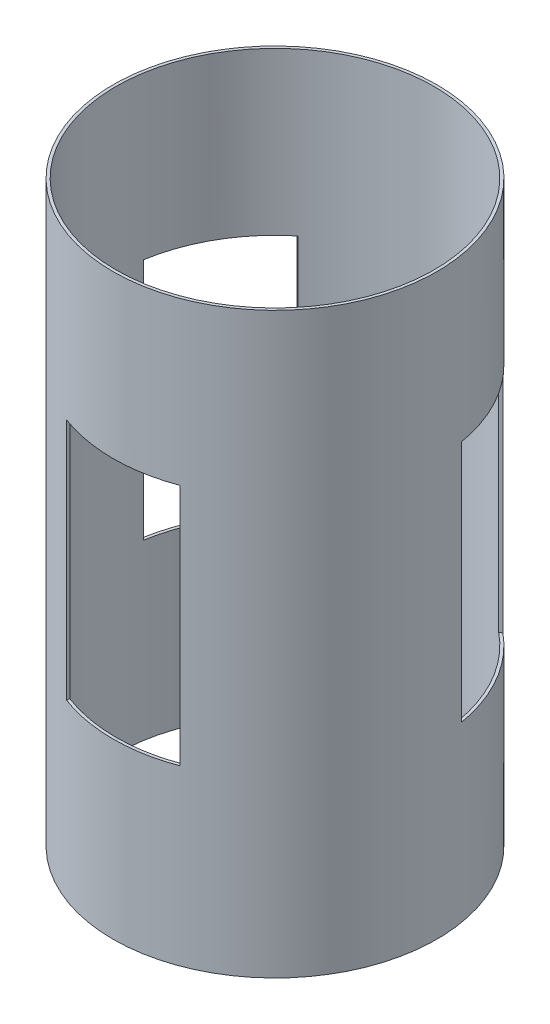
from build123d import *
from build123d.topology import SkipClean

# Parameters (mm, degrees)
BOSS_EXTRUDE7_DEPTH   = 105
BOSS_EXTRUDE7_2_DEPTH = 105
BOSS_EXTRUDE7_3_DEPTH = 105
BOSS_EXTRUDE8_START   = 105
BOSS_EXTRUDE8_DEPTH   = 70
BOSS_EXTRUDE9_START   = -75
BOSS_EXTRUDE9_DEPTH   = 75


with BuildPart() as part:
    # Sketch1 → Boss-Extrude7 (new body)
    with BuildSketch(Plane(origin=(0, 0, 0), x_dir=(1, 0, 0), z_dir=(0, 1, 0))):
        with BuildLine():
            ThreePointArc((44.560555468860024, 53.984783933129265), (3.537e-14, 70.00000000000001), (-44.56055546885996, 53.98478393312931))
            Line((-44.56055546886001, 53.984783933129364), (-43.403648557534325, 53.31684341644816))
            ThreePointArc((-43.403648557534325, 53.31684341644814), (1.28652e-12, 68.75), (43.403648557536336, 53.3168434164465))
            Line((43.40364855753577, 53.3168434164489), (44.56055546886009, 53.984783933129336))
        make_face()
    extrude(amount=BOSS_EXTRUDE7_DEPTH)



with BuildPart() as body_2:
    # Sketch1 → Boss-Extrude7 2 (new body)
    with BuildSketch(Plane(origin=(0, 0, 0), x_dir=(1, 0, 0), z_dir=(0, 1, 0))):
        with BuildLine():
            ThreePointArc((70.00000000000001, 0), (69.75769865284899, 5.819233511237749), (69.03247203833395, 11.598181076213804))
            Line((69.03247203833403, 11.59818107621382), (67.87556512700833, 10.930240559532546))
            ThreePointArc((67.87556512700833, 10.930240559532546), (68.53104261019901, 5.482581395573491), (68.75, 0))
            ThreePointArc((68.75, -1.684e-14), (56.60833315047941, -39.01357607198209), (24.471916569473954, -64.24708397598062))
            Line((24.47191656947394, -64.24708397598064), (24.471916569473937, -65.58296500934298))
            ThreePointArc((24.47191656947391, -65.58296500934301), (57.50232238728785, -39.91845337771012), (70.00000000000001, -1.715e-14))
        make_face()
    extrude(amount=BOSS_EXTRUDE7_2_DEPTH)


with BuildPart() as body_3:
    # Sketch1 → Boss-Extrude7 3 (new body)
    with BuildSketch(Plane(origin=(0, 0, 0), x_dir=(1, 0, 0), z_dir=(0, 1, 0))):
        with BuildLine():
            Line((-67.87556512700831, 10.93024055953267), (-69.03247203833394, 11.598181076213848))
            ThreePointArc((-69.03247203833394, 11.598181076213844), (-60.621778264910745, -34.999999999999964), (-24.471916569473937, -65.58296500934301))
            Line((-24.471916569473937, -65.58296500934298), (-24.47191656947394, -64.24708397598064))
            ThreePointArc((-24.47191656947398, -64.24708397598062), (-53.31684341644806, -43.40364855753442), (-67.87556512700831, -10.930240559532654))
            ThreePointArc((-67.87556512700831, -10.930240559532654), (-68.75, 8.42e-15), (-67.87556512700831, 10.93024055953267))
        make_face()
    extrude(amount=BOSS_EXTRUDE7_3_DEPTH)


with BuildPart() as part_1:
    add(part.part)

    add(body_2.part)  # Boss-Extrude8 merges body 2

    add(body_3.part)  # Boss-Extrude8 merges body 3
    # Sketch1<22> → Boss-Extrude8 (add)
    with BuildSketch(Plane(origin=(0, 0, 0), x_dir=(1, 0, 0), z_dir=(0, 1, 0)).offset(BOSS_EXTRUDE8_START)):
        with BuildLine():
            Line((-44.56055546886001, 53.984783933129364), (-46.48344921652614, 50.6542342646151))
            ThreePointArc((-46.4834492165269, 50.654234264615674), (-44.96326231975128, 52.008341076842996), (-43.403648557534325, 53.31684341644814))
            Line((-43.403648557534325, 53.31684341644816), (-44.56055546886001, 53.984783933129364))
        make_face()
        with BuildLine():
            ThreePointArc((-53.90604277152018, 42.669673688874596), (-50.353260344306015, 46.809311816117734), (-46.4834492165269, 50.654234264615674))
            Line((-46.48344921652614, 50.6542342646151), (-44.56055546886001, 53.984783933129364))
            ThreePointArc((-44.56055546885996, 53.98478393312931), (-50.06606053801366, 48.9222810404825), (-54.99999999999996, 43.30127018922201))
            Line((-54.99999999999998, 43.30127018922202), (-53.9060427715193, 42.66967368887677))
        make_face()
        with BuildLine():
            ThreePointArc((-63.90604277151851, 25.349165613188287), (-62.93593715669987, 27.670025554883836), (-61.88157858292415, 29.953843360834068))
            ThreePointArc((-61.88157858292415, 29.953843360834068), (-58.241878403455715, 36.530071174815404), (-53.90604277152018, 42.669673688874596))
            Line((-53.9060427715193, 42.66967368887677), (-54.99999999999998, 43.30127018922202))
            ThreePointArc((-54.99999999999996, 43.30127018922201), (-60.621778264910674, 35.000000000000085), (-64.99999999999997, 25.980762113533245))
            Line((-64.99999999999997, 25.980762113533242), (-63.90604277151891, 25.349165613187772))
        make_face()
        with BuildLine():
            Line((-69.03247203833394, 11.598181076213848), (-67.10957829067064, 14.92873074472319))
            ThreePointArc((-67.10957829066999, 14.928730744722952), (-65.71468333857909, 20.20254671347838), (-63.90604277151851, 25.349165613188287))
            Line((-63.90604277151891, 25.349165613187772), (-64.99999999999997, 25.980762113533242))
            ThreePointArc((-64.99999999999997, 25.980762113533245), (-67.40096846114643, 18.897339773088344), (-69.03247203833394, 11.598181076213844))
        make_face()
        with BuildLine():
            ThreePointArc((-67.87556512700831, 10.93024055953267), (-67.5221757411079, 12.935156867504151), (-67.10957829066999, 14.928730744722952))
            Line((-67.10957829067064, 14.92873074472319), (-69.03247203833394, 11.598181076213848))
            Line((-69.03247203833394, 11.598181076213848), (-67.87556512700831, 10.93024055953267))
        make_face()
        with BuildLine():
            Line((-67.87556512700831, 10.93024055953267), (-69.03247203833394, 11.598181076213848))
            ThreePointArc((-69.03247203833394, 11.598181076213844), (-60.621778264910745, -34.999999999999964), (-24.471916569473937, -65.58296500934301))
            Line((-24.471916569473937, -65.58296500934298), (-24.47191656947394, -64.24708397598064))
            ThreePointArc((-24.47191656947398, -64.24708397598062), (-53.31684341644806, -43.40364855753442), (-67.87556512700831, -10.930240559532654))
            ThreePointArc((-67.87556512700831, -10.930240559532654), (-68.75, 8.42e-15), (-67.87556512700831, 10.93024055953267))
        make_face()
        with BuildLine():
            Line((-24.47191656947394, -64.24708397598064), (-24.471916569473937, -65.58296500934298))
            Line((-24.471916569473937, -65.58296500934298), (-20.626129074147464, -65.58296500934298))
            ThreePointArc((-20.626129074147347, -65.58296500934227), (-22.558913421358792, -64.9434979443488), (-24.47191656947398, -64.24708397598062))
        make_face()
        with BuildLine():
            Line((-20.626129074147464, -65.58296500934298), (-24.471916569473937, -65.58296500934298))
            ThreePointArc((-24.471916569473937, -65.58296500934301), (-17.334907923132807, -67.81962081357068), (-10.000000000000046, -69.2820323027551))
            Line((-10.000000000000002, -69.28203230275511), (-10.000000000000002, -68.01883930206449))
            ThreePointArc((-9.999999999998154, -68.01883930206422), (-15.361422994275008, -67.01185852959877), (-20.626129074147347, -65.58296500934227))
        make_face()
        with BuildLine():
            Line((-10.000000000000002, -68.01883930206449), (-10.000000000000002, -69.28203230275511))
            ThreePointArc((-10.000000000000046, -69.2820323027551), (-1.286e-14, -70.00000000000001), (10.000000000000021, -69.2820323027551))
            Line((10.000000000000002, -69.28203230275511), (10.000000000000002, -68.01883930206453))
            ThreePointArc((9.999999999997948, -68.01883930206425), (7.5050235244553045, -68.33913316612505), (5.000000000000001, -68.56794075951238))
            ThreePointArc((5.000000000000001, -68.56794075951238), (-2.5150304377160433, -68.70398184892461), (-9.999999999998154, -68.01883930206422))
        make_face()
        with BuildLine():
            Line((20.626129074142252, -65.58296500934298), (24.471916569473937, -65.58296500934298))
            Line((24.471916569473937, -65.58296500934298), (24.47191656947394, -64.24708397598064))
            ThreePointArc((24.471916569473954, -64.24708397598062), (22.55891342135629, -64.94349794434969), (20.62612907414237, -65.58296500934384))
        make_face()
        with BuildLine():
            Line((10.000000000000002, -68.01883930206453), (10.000000000000002, -69.28203230275511))
            ThreePointArc((10.000000000000021, -69.2820323027551), (17.334907923132782, -67.8196208135707), (24.47191656947391, -65.58296500934301))
            Line((24.471916569473937, -65.58296500934298), (20.626129074142252, -65.58296500934298))
            ThreePointArc((20.62612907414237, -65.58296500934384), (15.361422994272365, -67.01185852959937), (9.999999999997948, -68.01883930206425))
        make_face()
        with BuildLine():
            ThreePointArc((70.00000000000001, 0), (69.75769865284899, 5.819233511237749), (69.03247203833395, 11.598181076213804))
            Line((69.03247203833403, 11.59818107621382), (67.87556512700833, 10.930240559532546))
            ThreePointArc((67.87556512700833, 10.930240559532546), (68.53104261019901, 5.482581395573491), (68.75, 0))
            ThreePointArc((68.75, -1.684e-14), (56.60833315047941, -39.01357607198209), (24.471916569473954, -64.24708397598062))
            Line((24.47191656947394, -64.24708397598064), (24.471916569473937, -65.58296500934298))
            ThreePointArc((24.47191656947391, -65.58296500934301), (57.50232238728785, -39.91845337771012), (70.00000000000001, -1.715e-14))
        make_face()
        with BuildLine():
            Line((67.87556512700833, 10.930240559532546), (69.03247203833403, 11.59818107621382))
            Line((69.03247203833403, 11.59818107621382), (67.10957829066899, 14.928730744726206))
            ThreePointArc((67.10957829066923, 14.9287307447263), (67.52217574110759, 12.935156867505773), (67.87556512700833, 10.930240559532546))
        make_face()
        with BuildLine():
            ThreePointArc((69.03247203833395, 11.598181076213804), (67.40096846114645, 18.897339773088273), (65.00000000000001, 25.980762113533164))
            Line((65.00000000000011, 25.980762113533206), (63.90604277151851, 25.349165613187427))
            ThreePointArc((63.906042771519196, 25.34916561318654), (65.71468333857887, 20.202546713479123), (67.10957829066923, 14.9287307447263))
            Line((67.10957829066899, 14.928730744726206), (69.03247203833403, 11.59818107621382))
        make_face()
        with BuildLine():
            ThreePointArc((65.00000000000001, 25.980762113533164), (60.62177826491072, 35), (55.00000000000002, 43.30127018922193))
            Line((55.0000000000001, 43.30127018922198), (53.90604277151935, 42.6696736888767))
            ThreePointArc((53.906042771520234, 42.66967368887453), (55.43091363224439, 40.669107611240534), (56.88157858292419, 38.614097398678375))
            ThreePointArc((56.88157858292419, 38.614097398678375), (60.75690884117242, 32.17391067410776), (63.906042771519196, 25.34916561318654))
            Line((63.90604277151851, 25.349165613187427), (65.00000000000011, 25.980762113533206))
        make_face()
        with BuildLine():
            ThreePointArc((55.00000000000002, 43.30127018922193), (50.0660605380137, 48.92228104048245), (44.560555468860024, 53.984783933129265))
            Line((44.56055546886009, 53.984783933129336), (46.48344921652566, 50.654234264616036))
            ThreePointArc((46.48344921652611, 50.6542342646164), (50.353260344305696, 46.809311816118075), (53.906042771520234, 42.66967368887453))
            Line((53.90604277151935, 42.6696736888767), (55.0000000000001, 43.30127018922198))
        make_face()
        with BuildLine():
            Line((44.56055546886009, 53.984783933129336), (43.40364855753577, 53.3168434164489))
            ThreePointArc((43.403648557536336, 53.3168434164465), (44.96326231975186, 52.0083410768425), (46.48344921652611, 50.6542342646164))
            Line((46.48344921652566, 50.654234264616036), (44.56055546886009, 53.984783933129336))
        make_face()
        with BuildLine():
            ThreePointArc((44.560555468860024, 53.984783933129265), (3.537e-14, 70.00000000000001), (-44.56055546885996, 53.98478393312931))
            Line((-44.56055546886001, 53.984783933129364), (-43.403648557534325, 53.31684341644816))
            ThreePointArc((-43.403648557534325, 53.31684341644814), (1.28652e-12, 68.75), (43.403648557536336, 53.3168434164465))
            Line((43.40364855753577, 53.3168434164489), (44.56055546886009, 53.984783933129336))
        make_face()
    extrude(amount=BOSS_EXTRUDE8_DEPTH)

    # Sketch1<23> → Boss-Extrude9 (add)
    with SkipClean():  # the faces are left unmerged after this step: merging them gives an invalid solid
        with BuildSketch(Plane(origin=(0, 0, 0), x_dir=(1, 0, 0), z_dir=(0, 1, 0)).offset(BOSS_EXTRUDE9_START)):
            with BuildLine():
                ThreePointArc((-53.90604277152018, 42.669673688874596), (-50.353260344306015, 46.809311816117734), (-46.4834492165269, 50.654234264615674))
                Line((-46.48344921652614, 50.6542342646151), (-44.56055546886001, 53.984783933129364))
                ThreePointArc((-44.56055546885996, 53.98478393312931), (-50.06606053801366, 48.9222810404825), (-54.99999999999996, 43.30127018922201))
                Line((-54.99999999999998, 43.30127018922202), (-53.9060427715193, 42.66967368887677))
            make_face()
            with BuildLine():
                ThreePointArc((-63.90604277151851, 25.349165613188287), (-62.93593715669987, 27.670025554883836), (-61.88157858292415, 29.953843360834068))
                ThreePointArc((-61.88157858292415, 29.953843360834068), (-58.241878403455715, 36.530071174815404), (-53.90604277152018, 42.669673688874596))
                Line((-53.9060427715193, 42.66967368887677), (-54.99999999999998, 43.30127018922202))
                ThreePointArc((-54.99999999999996, 43.30127018922201), (-60.621778264910674, 35.000000000000085), (-64.99999999999997, 25.980762113533245))
                Line((-64.99999999999997, 25.980762113533242), (-63.90604277151891, 25.349165613187772))
            make_face()
            with BuildLine():
                Line((-69.03247203833394, 11.598181076213848), (-67.10957829067064, 14.92873074472319))
                ThreePointArc((-67.10957829066999, 14.928730744722952), (-65.71468333857909, 20.20254671347838), (-63.90604277151851, 25.349165613188287))
                Line((-63.90604277151891, 25.349165613187772), (-64.99999999999997, 25.980762113533242))
                ThreePointArc((-64.99999999999997, 25.980762113533245), (-67.40096846114643, 18.897339773088344), (-69.03247203833394, 11.598181076213844))
            make_face()
            with BuildLine():
                ThreePointArc((-67.87556512700831, 10.93024055953267), (-67.5221757411079, 12.935156867504151), (-67.10957829066999, 14.928730744722952))
                Line((-67.10957829067064, 14.92873074472319), (-69.03247203833394, 11.598181076213848))
                Line((-69.03247203833394, 11.598181076213848), (-67.87556512700831, 10.93024055953267))
            make_face()
            with BuildLine():
                Line((-67.87556512700831, 10.93024055953267), (-69.03247203833394, 11.598181076213848))
                ThreePointArc((-69.03247203833394, 11.598181076213844), (-60.621778264910745, -34.999999999999964), (-24.471916569473937, -65.58296500934301))
                Line((-24.471916569473937, -65.58296500934298), (-24.47191656947394, -64.24708397598064))
                ThreePointArc((-24.47191656947398, -64.24708397598062), (-53.31684341644806, -43.40364855753442), (-67.87556512700831, -10.930240559532654))
                ThreePointArc((-67.87556512700831, -10.930240559532654), (-68.75, 8.42e-15), (-67.87556512700831, 10.93024055953267))
            make_face()
            with BuildLine():
                Line((-44.56055546886001, 53.984783933129364), (-46.48344921652614, 50.6542342646151))
                ThreePointArc((-46.4834492165269, 50.654234264615674), (-44.96326231975128, 52.008341076842996), (-43.403648557534325, 53.31684341644814))
                Line((-43.403648557534325, 53.31684341644816), (-44.56055546886001, 53.984783933129364))
            make_face()
            with BuildLine():
                ThreePointArc((44.560555468860024, 53.984783933129265), (3.537e-14, 70.00000000000001), (-44.56055546885996, 53.98478393312931))
                Line((-44.56055546886001, 53.984783933129364), (-43.403648557534325, 53.31684341644816))
                ThreePointArc((-43.403648557534325, 53.31684341644814), (1.28652e-12, 68.75), (43.403648557536336, 53.3168434164465))
                Line((43.40364855753577, 53.3168434164489), (44.56055546886009, 53.984783933129336))
            make_face()
            with BuildLine():
                Line((44.56055546886009, 53.984783933129336), (43.40364855753577, 53.3168434164489))
                ThreePointArc((43.403648557536336, 53.3168434164465), (44.96326231975186, 52.0083410768425), (46.48344921652611, 50.6542342646164))
                Line((46.48344921652566, 50.654234264616036), (44.56055546886009, 53.984783933129336))
            make_face()
            with BuildLine():
                ThreePointArc((55.00000000000002, 43.30127018922193), (50.0660605380137, 48.92228104048245), (44.560555468860024, 53.984783933129265))
                Line((44.56055546886009, 53.984783933129336), (46.48344921652566, 50.654234264616036))
                ThreePointArc((46.48344921652611, 50.6542342646164), (50.353260344305696, 46.809311816118075), (53.906042771520234, 42.66967368887453))
                Line((53.90604277151935, 42.6696736888767), (55.0000000000001, 43.30127018922198))
            make_face()
            with BuildLine():
                ThreePointArc((65.00000000000001, 25.980762113533164), (60.62177826491072, 35), (55.00000000000002, 43.30127018922193))
                Line((55.0000000000001, 43.30127018922198), (53.90604277151935, 42.6696736888767))
                ThreePointArc((53.906042771520234, 42.66967368887453), (55.43091363224439, 40.669107611240534), (56.88157858292419, 38.614097398678375))
                ThreePointArc((56.88157858292419, 38.614097398678375), (60.75690884117242, 32.17391067410776), (63.906042771519196, 25.34916561318654))
                Line((63.90604277151851, 25.349165613187427), (65.00000000000011, 25.980762113533206))
            make_face()
            with BuildLine():
                ThreePointArc((69.03247203833395, 11.598181076213804), (67.40096846114645, 18.897339773088273), (65.00000000000001, 25.980762113533164))
                Line((65.00000000000011, 25.980762113533206), (63.90604277151851, 25.349165613187427))
                ThreePointArc((63.906042771519196, 25.34916561318654), (65.71468333857887, 20.202546713479123), (67.10957829066923, 14.9287307447263))
                Line((67.10957829066899, 14.928730744726206), (69.03247203833403, 11.59818107621382))
            make_face()
            with BuildLine():
                Line((67.87556512700833, 10.930240559532546), (69.03247203833403, 11.59818107621382))
                Line((69.03247203833403, 11.59818107621382), (67.10957829066899, 14.928730744726206))
                ThreePointArc((67.10957829066923, 14.9287307447263), (67.52217574110759, 12.935156867505773), (67.87556512700833, 10.930240559532546))
            make_face()
            with BuildLine():
                ThreePointArc((70.00000000000001, 0), (69.75769865284899, 5.819233511237749), (69.03247203833395, 11.598181076213804))
                Line((69.03247203833403, 11.59818107621382), (67.87556512700833, 10.930240559532546))
                ThreePointArc((67.87556512700833, 10.930240559532546), (68.53104261019901, 5.482581395573491), (68.75, 0))
                ThreePointArc((68.75, -1.684e-14), (56.60833315047941, -39.01357607198209), (24.471916569473954, -64.24708397598062))
                Line((24.47191656947394, -64.24708397598064), (24.471916569473937, -65.58296500934298))
                ThreePointArc((24.47191656947391, -65.58296500934301), (57.50232238728785, -39.91845337771012), (70.00000000000001, -1.715e-14))
            make_face()
            with BuildLine():
                Line((-24.47191656947394, -64.24708397598064), (-24.471916569473937, -65.58296500934298))
                Line((-24.471916569473937, -65.58296500934298), (-20.626129074147464, -65.58296500934298))
                ThreePointArc((-20.626129074147347, -65.58296500934227), (-22.558913421358792, -64.9434979443488), (-24.47191656947398, -64.24708397598062))
            make_face()
            with BuildLine():
                Line((-20.626129074147464, -65.58296500934298), (-24.471916569473937, -65.58296500934298))
                ThreePointArc((-24.471916569473937, -65.58296500934301), (-17.334907923132807, -67.81962081357068), (-10.000000000000046, -69.2820323027551))
                Line((-10.000000000000002, -69.28203230275511), (-10.000000000000002, -68.01883930206449))
                ThreePointArc((-9.999999999998154, -68.01883930206422), (-15.361422994275008, -67.01185852959877), (-20.626129074147347, -65.58296500934227))
            make_face()
            with BuildLine():
                Line((-10.000000000000002, -68.01883930206449), (-10.000000000000002, -69.28203230275511))
                ThreePointArc((-10.000000000000046, -69.2820323027551), (-1.286e-14, -70.00000000000001), (10.000000000000021, -69.2820323027551))
                Line((10.000000000000002, -69.28203230275511), (10.000000000000002, -68.01883930206453))
                ThreePointArc((9.999999999997948, -68.01883930206425), (7.5050235244553045, -68.33913316612505), (5.000000000000001, -68.56794075951238))
                ThreePointArc((5.000000000000001, -68.56794075951238), (-2.5150304377160433, -68.70398184892461), (-9.999999999998154, -68.01883930206422))
            make_face()
            with BuildLine():
                Line((20.626129074142252, -65.58296500934298), (24.471916569473937, -65.58296500934298))
                Line((24.471916569473937, -65.58296500934298), (24.47191656947394, -64.24708397598064))
                ThreePointArc((24.471916569473954, -64.24708397598062), (22.55891342135629, -64.94349794434969), (20.62612907414237, -65.58296500934384))
            make_face()
            with BuildLine():
                Line((10.000000000000002, -68.01883930206453), (10.000000000000002, -69.28203230275511))
                ThreePointArc((10.000000000000021, -69.2820323027551), (17.334907923132782, -67.8196208135707), (24.47191656947391, -65.58296500934301))
                Line((24.471916569473937, -65.58296500934298), (20.626129074142252, -65.58296500934298))
                ThreePointArc((20.62612907414237, -65.58296500934384), (15.361422994272365, -67.01185852959937), (9.999999999997948, -68.01883930206425))
            make_face()
        extrude(amount=BOSS_EXTRUDE9_DEPTH)


solid = part_1.part
